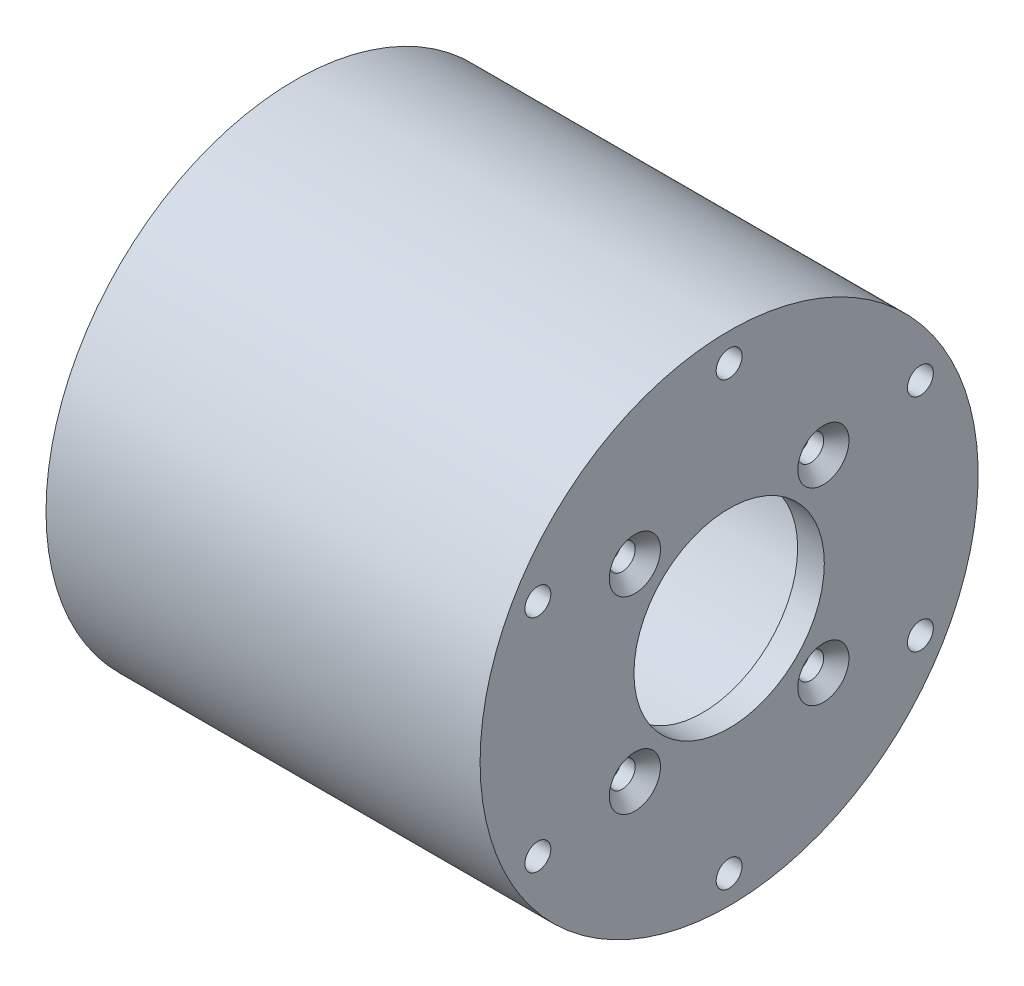
from build123d import *

# Parameters (mm, degrees)
CROQUIS1_R                                           = 32.7
CROQUIS1_R_2                                         = 21
SALIENTE_EXTRUIR1_DEPTH                              = 24.25
SALIENTE_EXTRUIR2_START                              = 3.5
CROQUIS2_R                                           = 32.7
CROQUIS2_R_2                                         = 12.5
SALIENTE_EXTRUIR2_DEPTH                              = 3.5
CROQUIS3_R                                           = 32.7
SALIENTE_EXTRUIR3_DEPTH                              = 5
CROQUIS4_R                                           = 3.5
CORTAR_EXTRUIR1_DEPTH                                = 6
REFRENTADO_PARA_TORNILLO_TAP_N_CON_CABEZ_D           = 3.4
REFRENTADO_PARA_TORNILLO_TAP_N_CON_CABEZ_CSINK_D     = 6.72
REFRENTADO_PARA_TORNILLO_TAP_N_CON_CABEZ_CSINK_ANGLE = 90
TALADRO_DE_MARGEN_PARA_M31_D                         = 3.4
TALADRO_DE_MARGEN_PARA_M31_DEPTH                     = 15
TALADRO_DE_MARGEN_PARA_M31_TIP                       = 1.021463052


with BuildPart() as part:
    # Croquis1 → Saliente-Extruir1 (new, symmetric)
    with BuildSketch(Plane(origin=(0, 0, 0), x_dir=(0, 0, -1), z_dir=(1, 0, 0))):
        with Locations(Location((0, 0, 0), (0, 0, 180))):
            Circle(CROQUIS1_R)
        with Locations(Location((0, 0, 0), (0, 0, 180))):
            Circle(CROQUIS1_R_2, mode=Mode.SUBTRACT)
    extrude(amount=SALIENTE_EXTRUIR1_DEPTH, both=True)

    # Croquis2 → Saliente-Extruir2 (add)
    with BuildSketch(Plane(origin=(24.25, 0, 0), x_dir=(0, 0, -1), z_dir=(1, 0, 0)).offset(SALIENTE_EXTRUIR2_START)):
        with Locations(Location((0, 0, 0), (0, 0, 180))):
            Circle(CROQUIS2_R)
        Circle(CROQUIS2_R_2, mode=Mode.SUBTRACT)
    extrude(amount=-SALIENTE_EXTRUIR2_DEPTH)

    # Croquis3 → Saliente-Extruir3 (add)
    with BuildSketch(Plane.ZY.offset(24.25)):
        Circle(CROQUIS3_R)
        with BuildLine():
            Line((-18, 21), (18, 21))
            ThreePointArc((18, 21), (20.121320344, 20.121320344), (21, 18))
            Line((21, 18), (21, -18))
            ThreePointArc((21, -18), (20.121320344, -20.121320344), (18, -21))
            Line((18, -21), (-18, -21))
            ThreePointArc((-18, -21), (-20.121320344, -20.121320344), (-21, -18))
            Line((-21, -18), (-21, 18))
            ThreePointArc((-21, 18), (-20.121320344, 20.121320344), (-18, 21))
        make_face(mode=Mode.SUBTRACT)
    extrude(amount=SALIENTE_EXTRUIR3_DEPTH)

    # Croquis4 → Cortar-Extruir1 (cut)
    with BuildSketch(Plane.ZY.offset(24.25)):
        with Locations((15.5, 15.5)):
            Circle(CROQUIS4_R)
        with Locations((-15.5, 15.5)):
            Circle(CROQUIS4_R)
        with Locations((-15.5, -15.5)):
            Circle(CROQUIS4_R)
        with Locations((15.5, -15.5)):
            Circle(CROQUIS4_R)
    extrude(amount=-CORTAR_EXTRUIR1_DEPTH, mode=Mode.SUBTRACT)

    # Refrentado para tornillo tapón con cabeza plana de clavija de M32 (through all)
    with Locations(Plane(origin=(27.75, 0, 0), x_dir=(0, 0, -1), z_dir=(1, 0, 0))):
        with Locations((12.375, 12.375), (-12.375, -12.375), (-12.375, 12.375), (12.375, -12.375)):
            CounterSinkHole(REFRENTADO_PARA_TORNILLO_TAP_N_CON_CABEZ_D / 2, REFRENTADO_PARA_TORNILLO_TAP_N_CON_CABEZ_CSINK_D / 2, counter_sink_angle=REFRENTADO_PARA_TORNILLO_TAP_N_CON_CABEZ_CSINK_ANGLE)

    # Taladro de margen para M31
    with Locations(Plane(origin=(27.75, 0, 0), x_dir=(0, 0, -1), z_dir=(1, 0, 0))):
        with Locations((0, 29), (25.11473671, 14.5), (25.11473671, -14.5), (0, -29), (-25.11473671, -14.5), (-25.11473671, 14.5)):
            Hole(TALADRO_DE_MARGEN_PARA_M31_D / 2, depth=TALADRO_DE_MARGEN_PARA_M31_DEPTH)
            with Locations((0, 0, -(TALADRO_DE_MARGEN_PARA_M31_DEPTH + TALADRO_DE_MARGEN_PARA_M31_TIP / 2))):  # 118° drill point
                Cone(0, TALADRO_DE_MARGEN_PARA_M31_D / 2, TALADRO_DE_MARGEN_PARA_M31_TIP, mode=Mode.SUBTRACT)


solid = part.part
